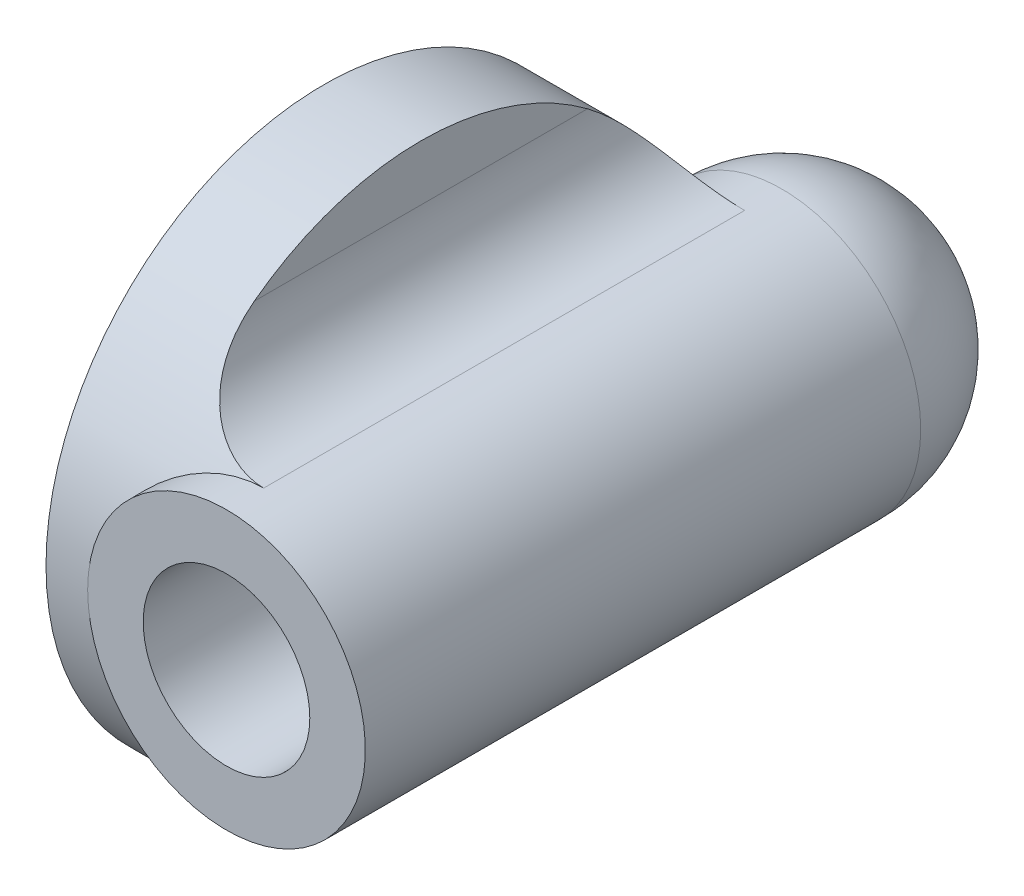
from build123d import *
from build123d.topology import SkipClean

# Parameters (mm, degrees)
SKETCH1_R                = 10
SKETCH1_R_2              = 6
BOSS_EXTRUDE1_DEPTH      = 40
BOSS_EXTRUDE4_DEPTH      = 3
BOSS_EXTRUDE4_DEPTH_BACK = 4
SKETCH7_R                = 20
FILLET3_R                = 6
SKETCH8_R                = 15
CUT_EXTRUDE3_DEPTH       = 2


with BuildPart() as part:
    # Sketch1 → Boss-Extrude1 (new body)
    with BuildSketch(Plane.XY):
        Circle(SKETCH1_R)
        Circle(SKETCH1_R_2, mode=Mode.SUBTRACT)
    extrude(amount=BOSS_EXTRUDE1_DEPTH)

    # Sketch6 → Revolve1 (revolve)
    with BuildSketch(Plane(origin=(0, 0, 0), x_dir=(1, 0, 0), z_dir=(0, 1, 0))):
        with BuildLine():
            Line((-10, 0), (0, 0))
            Line((0, 0), (0, 10))
            ThreePointArc((0, 10), (-7.071067812, 7.071067812), (-10, 0))
        make_face()
    revolve(axis=Axis((0, 0, -10), (0, 0, 1)))

    # Sketch7 → Boss-Extrude4 (add, two sides: drawn at the far end of the back side and taken through both)
    with SkipClean():  # the faces are left unmerged after this step: merging them gives an invalid solid
        with BuildSketch(Plane.ZY.offset(10).offset(-BOSS_EXTRUDE4_DEPTH_BACK)):
            with Locations((20, 0)):
                Circle(SKETCH7_R)
        extrude(amount=BOSS_EXTRUDE4_DEPTH + BOSS_EXTRUDE4_DEPTH_BACK)

    # Fillet3
    fillet3_edges = [part.edges().sort_by_distance(p)[0] for p in [
        (-6, 8, 20),
        (-6, -8, 20),
    ]]
    fillet(fillet3_edges, radius=FILLET3_R)

    # Sketch8 → Cut-Extrude3 (cut)
    with BuildSketch(Plane.ZY.offset(13)):
        with Locations((20, 0)):
            Circle(SKETCH8_R)
    extrude(amount=-CUT_EXTRUDE3_DEPTH, mode=Mode.SUBTRACT)


solid = part.part
